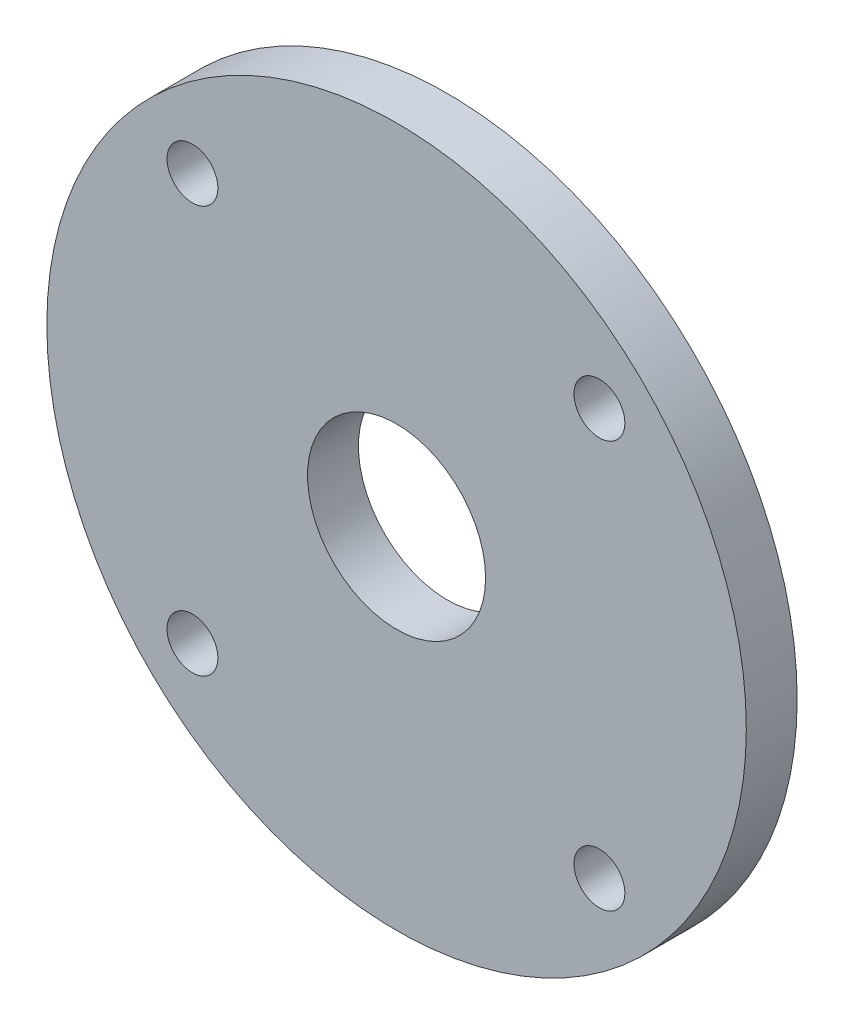
from build123d import *

# Parameters (mm, degrees)
SKETCH1_R           = 27.5
BOSS_EXTRUDE1_DEPTH = 4
CUT_EXTRUDE1_DEPTH  = 4
SKETCH3_R           = 7
CUT_EXTRUDE2_DEPTH  = 4


with BuildPart() as part:
    # Sketch1 → Boss-Extrude1 (new body)
    with BuildSketch(Plane.XY):
        Circle(SKETCH1_R)
    extrude(amount=BOSS_EXTRUDE1_DEPTH)

    # Sketch2 → Cut-Extrude1 (cut)
    with BuildSketch(Plane.XY.offset(4)):
        with BuildLine():
            ThreePointArc((-14.049415004, 16.024707502), (-16.049415004, 18.024707502), (-18.049415004, 16.024707502))
            ThreePointArc((-18.049415004, 16.024707502), (-16.049415004, 14.024707502), (-14.049415004, 16.024707502))
        make_face()
        with BuildLine():
            ThreePointArc((-14.049415004, -15.975292498), (-16.049415004, -13.975292498), (-18.049415004, -15.975292498))
            ThreePointArc((-18.049415004, -15.975292498), (-16.049415004, -17.975292498), (-14.049415004, -15.975292498))
        make_face()
        with BuildLine():
            ThreePointArc((13.950584996, -15.975292498), (15.950584996, -17.975292498), (17.950584996, -15.975292498))
            ThreePointArc((17.950584996, -15.975292498), (15.950584996, -13.975292498), (13.950584996, -15.975292498))
        make_face()
        with BuildLine():
            ThreePointArc((13.950584996, 16.024707502), (15.950584996, 14.024707502), (17.950584996, 16.024707502))
            ThreePointArc((17.950584996, 16.024707502), (15.950584996, 18.024707502), (13.950584996, 16.024707502))
        make_face()
    extrude(amount=-CUT_EXTRUDE1_DEPTH, mode=Mode.SUBTRACT)

    # Sketch3 → Cut-Extrude2 (cut)
    with BuildSketch(Plane.XY.offset(4)):
        Circle(SKETCH3_R)
    extrude(amount=-CUT_EXTRUDE2_DEPTH, mode=Mode.SUBTRACT)


solid = part.part
